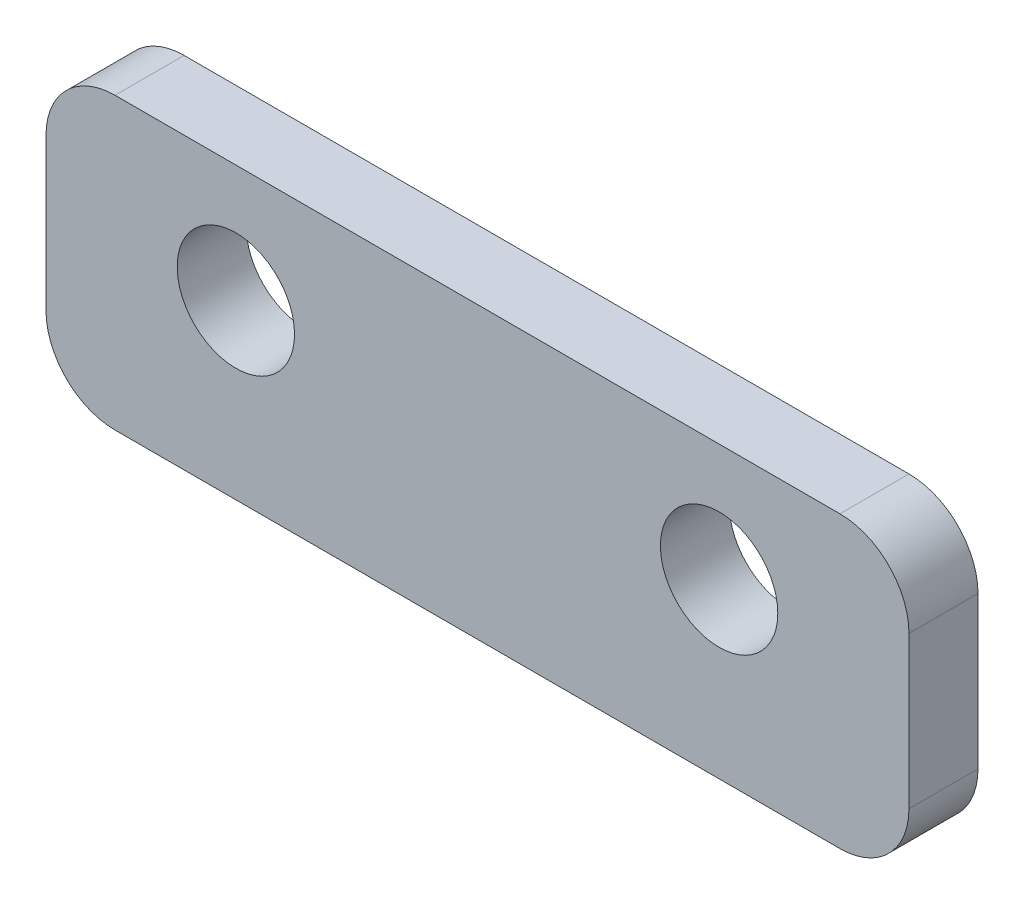
from build123d import *

# Parameters (mm, degrees)
SKETCH1_W            = 25
SKETCH1_H            = 10
BOSS_EXTRUDE1_DEPTH  = 2
M3_CLEARANCE_HOLE1_D = 3.4
SKETCH5_W            = 25
SKETCH5_H            = 2
CUT_EXTRUDE1_DEPTH   = 1.6
FILLET1_R            = 2


with BuildPart() as part:
    # Sketch1 → Boss-Extrude1 (new body)
    with BuildSketch(Plane.XY):
        Rectangle(SKETCH1_W, SKETCH1_H)
    extrude(amount=BOSS_EXTRUDE1_DEPTH)

    # M3 Clearance Hole1 (through all)
    with Locations(Plane.XY.offset(2)):
        with Locations((-7, 0), (7, 0)):
            Hole(M3_CLEARANCE_HOLE1_D / 2)

    # Sketch5 → Cut-Extrude1 (cut)
    with BuildSketch(Plane(origin=(0, 5, 0), x_dir=(1, 0, 0), z_dir=(0, 1, 0))):
        with Locations((0, -1)):
            Rectangle(SKETCH5_W, SKETCH5_H)
    extrude(amount=-CUT_EXTRUDE1_DEPTH, mode=Mode.SUBTRACT)

    # Fillet1
    fillet1_edges = [part.edges().sort_by_distance(p)[0] for p in [
        (12.5, 3.4, 1),
        (-12.5, 3.4, 1),
        (12.5, -5, 1),
        (-12.5, -5, 1),
    ]]
    fillet(fillet1_edges, radius=FILLET1_R)


solid = part.part
